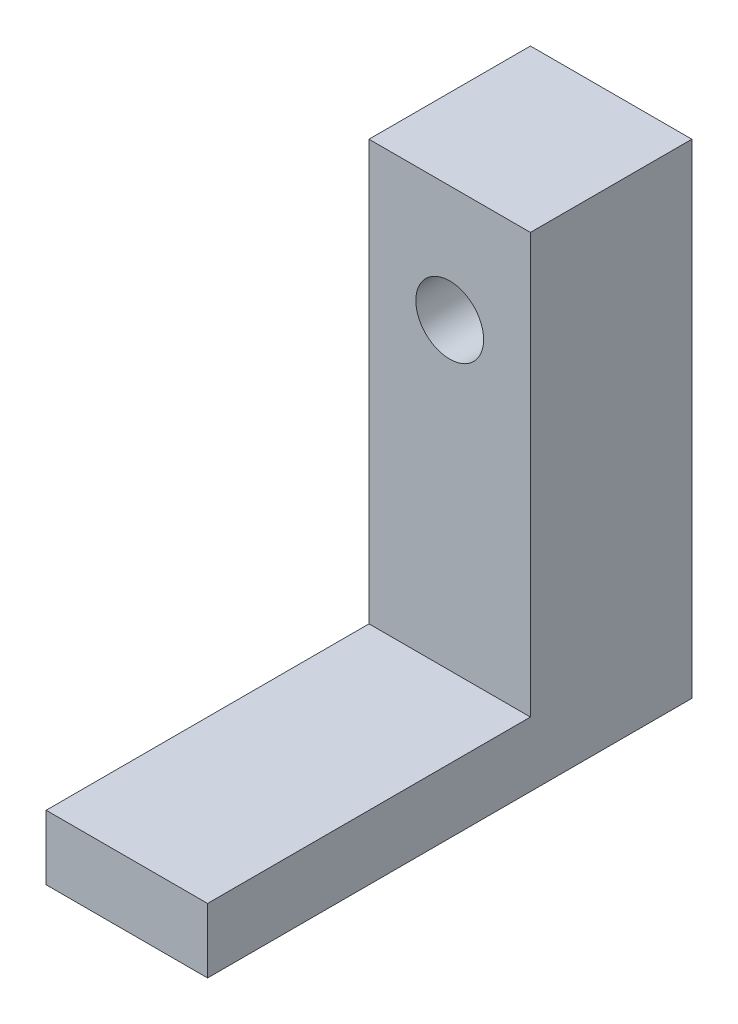
from build123d import *

# Parameters (mm, degrees)
SKETCH1_W           = 5
SKETCH1_H           = 15
BOSS_EXTRUDE1_DEPTH = 5
SKETCH2_W           = 5
SKETCH2_H           = 2
BOSS_EXTRUDE2_DEPTH = 10
SKETCH3_R           = 1.05
CUT_EXTRUDE1_DEPTH  = 10


with BuildPart() as part:
    # Sketch1 → Boss-Extrude1 (new body)
    with BuildSketch(Plane.XY):
        with Locations((2.5, 7.5)):
            Rectangle(SKETCH1_W, SKETCH1_H)
    extrude(amount=BOSS_EXTRUDE1_DEPTH)

    # Sketch2 → Boss-Extrude2 (add)
    with BuildSketch(Plane.XY.offset(5)):
        with Locations((2.5, 1)):
            Rectangle(SKETCH2_W, SKETCH2_H)
    extrude(amount=BOSS_EXTRUDE2_DEPTH)

    # Sketch3 → Cut-Extrude1 (cut)
    with BuildSketch(Plane.XY.offset(5)):
        with Locations((2.5, 11.4)):
            Circle(SKETCH3_R)
    extrude(amount=-CUT_EXTRUDE1_DEPTH, mode=Mode.SUBTRACT)


solid = part.part
